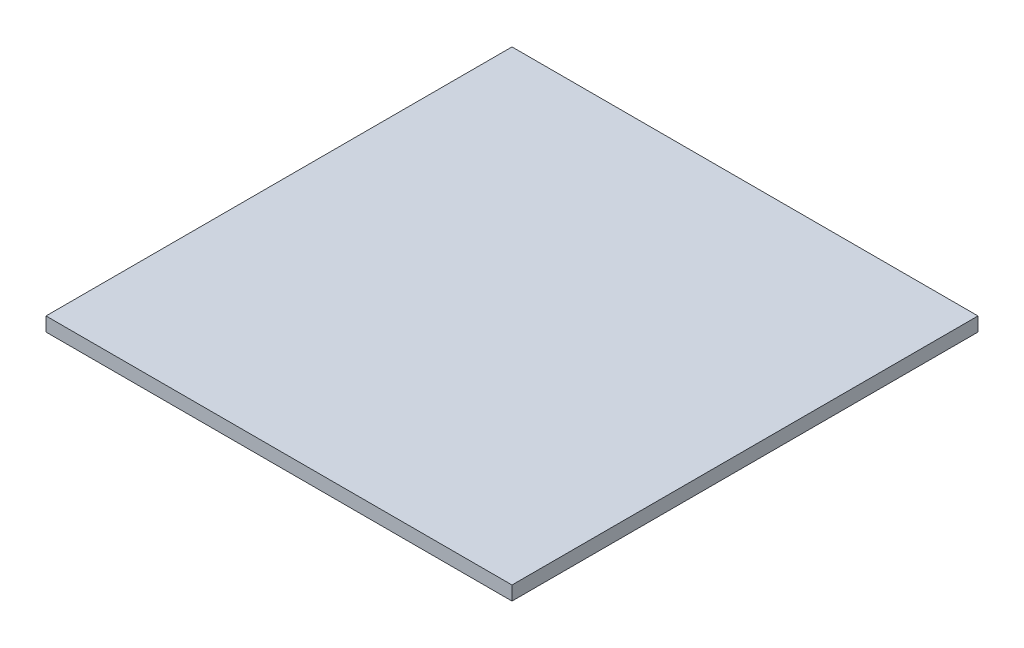
from build123d import *

# Parameters (mm, degrees)
SKETCH1_W           = 100
SKETCH1_H           = 100
BOSS_EXTRUDE1_DEPTH = 3


with BuildPart() as part:
    # Sketch1 → Boss-Extrude1 (new body)
    with BuildSketch(Plane(origin=(0, 0, 0), x_dir=(1, 0, 0), z_dir=(0, 1, 0))):
        with Locations((-53.4375, 57.1875)):
            Rectangle(SKETCH1_W, SKETCH1_H)
    extrude(amount=BOSS_EXTRUDE1_DEPTH)


solid = part.part
